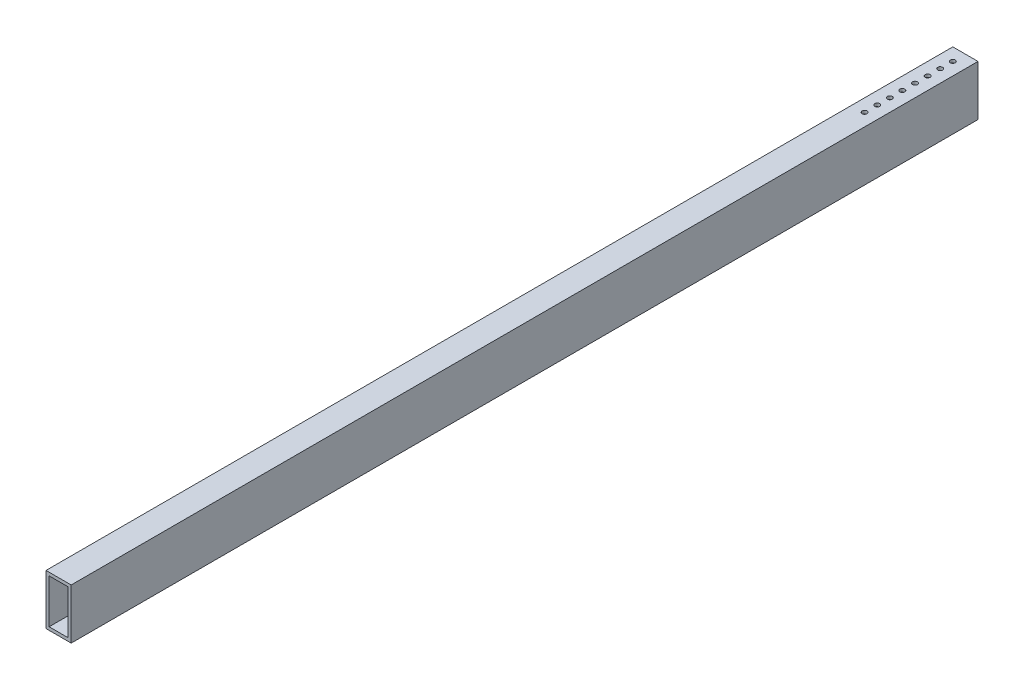
from build123d import *

# Parameters (mm, degrees)
SKETCH1_W           = 25.4
SKETCH1_H           = 50.8
SKETCH1_W_2         = 19.05
SKETCH1_H_2         = 44.45
BOSS_EXTRUDE1_DEPTH = 914.4
SKETCH2_R           = 2.4892
CUT_EXTRUDE1_DEPTH  = 916.898078391


with BuildPart() as part:
    # Sketch1 → Boss-Extrude1 (new body)
    with BuildSketch(Plane.XY):
        Rectangle(SKETCH1_W, SKETCH1_H)
        Rectangle(SKETCH1_W_2, SKETCH1_H_2, mode=Mode.SUBTRACT)
    extrude(amount=BOSS_EXTRUDE1_DEPTH)

    # Sketch2 → Cut-Extrude1 (cut, through all)
    with BuildSketch(Plane(origin=(0, 25.4, 0), x_dir=(1, 0, 0), z_dir=(0, 1, 0))):
        with Locations(Location((0, -12.7, 0), (0, 0, 270))):
            Circle(SKETCH2_R)
        with Locations(Location((0, -25.4, 0), (0, 0, 270))):
            Circle(SKETCH2_R)
        with Locations(Location((0, -38.1, 0), (0, 0, 270))):
            Circle(SKETCH2_R)
        with Locations(Location((0, -50.8, 0), (0, 0, 270))):
            Circle(SKETCH2_R)
        with Locations(Location((0, -63.5, 0), (0, 0, 270))):
            Circle(SKETCH2_R)
        with Locations(Location((0, -76.2, 0), (0, 0, 270))):
            Circle(SKETCH2_R)
        with Locations(Location((0, -88.9, 0), (0, 0, 270))):
            Circle(SKETCH2_R)
        with Locations(Location((0, -101.6, 0), (0, 0, 270))):
            Circle(SKETCH2_R)
    extrude(amount=-CUT_EXTRUDE1_DEPTH, mode=Mode.SUBTRACT)


solid = part.part
